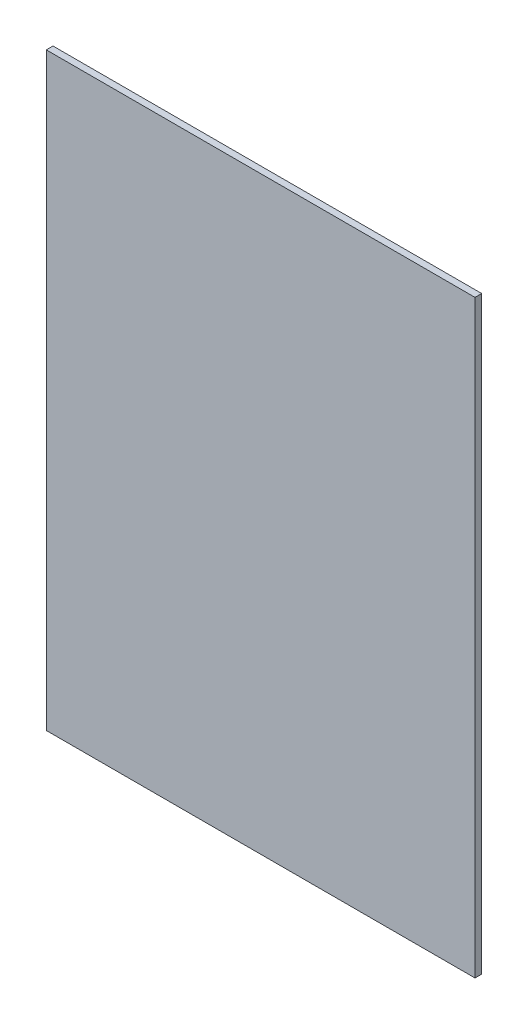
from build123d import *

# Parameters (mm, degrees)
SKETCH1_W           = 203.2
SKETCH1_H           = 279.4
BOSS_EXTRUDE4_DEPTH = 3.175


with BuildPart() as part:
    # Sketch1 → Boss-Extrude4 (new body)
    with BuildSketch(Plane.XY):
        with Locations((101.6, 139.7)):
            Rectangle(SKETCH1_W, SKETCH1_H)
    extrude(amount=BOSS_EXTRUDE4_DEPTH)


solid = part.part
